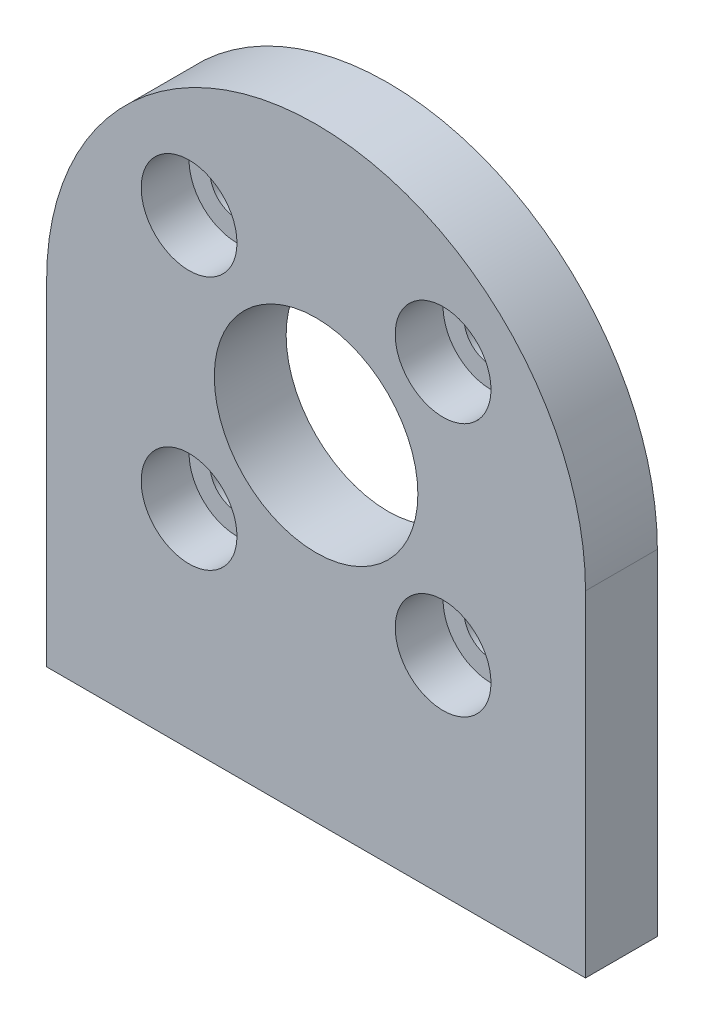
from build123d import *

# Parameters (mm, degrees)
EXTRUDE_1_DEPTH             = 6
SKETCH_2_R                  = 8.5
CUT_EXTRUDE_1_DEPTH         = 68.906185285
HOLE_WIZARD_M41_D           = 4.5
HOLE_WIZARD_M41_CBORE_D     = 8
HOLE_WIZARD_M41_CBORE_DEPTH = 4


with BuildPart() as part:
    # Эскиз1 → Бобышка-Вытянуть1 (new body)
    with BuildSketch(Plane.XY):
        with BuildLine():
            Line((0, 28), (0, 0))
            Line((0, 0), (45, 0))
            Line((45, 0), (45, 28))
            ThreePointArc((45, 28), (22.5, 50.5), (0, 28))
        make_face()
    extrude(amount=EXTRUDE_1_DEPTH)

    # Эскиз2 → Вырез-Вытянуть1 (cut, through all)
    with BuildSketch(Plane.XY.offset(6)):
        with Locations((22.5, 28)):
            Circle(SKETCH_2_R)
    extrude(amount=-CUT_EXTRUDE_1_DEPTH, mode=Mode.SUBTRACT)

    # Цековка для винта с внутренним шестигранником M41 (through all)
    with Locations(Plane.XY.offset(6)):
        with Locations((11.893398282, 38.606601718), (33.106601718, 38.606601718), (33.106601718, 17.393398282), (11.893398282, 17.393398282)):
            CounterBoreHole(HOLE_WIZARD_M41_D / 2, HOLE_WIZARD_M41_CBORE_D / 2, HOLE_WIZARD_M41_CBORE_DEPTH)


solid = part.part
